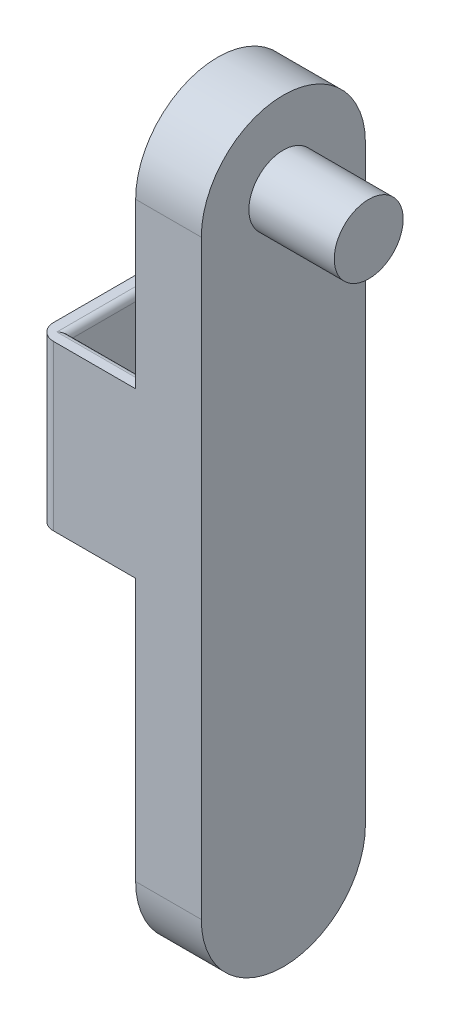
from build123d import *

# Parameters (mm, degrees)
BOSS_EXTRUDE1_DEPTH = 2
SKETCH2_R           = 1.05
BOSS_EXTRUDE2_DEPTH = 2.6
SKETCH3_W           = 3
SKETCH3_H           = 5
BOSS_EXTRUDE3_DEPTH = 5
SKETCH4_W           = 2
SKETCH4_H           = 4
CUT_EXTRUDE1_DEPTH  = 24.631588809
FILLET1_R           = 0.5
FILLET2_R           = 0.2


with BuildPart() as part:
    # Sketch1 → Boss-Extrude1 (new body)
    with BuildSketch(Plane(origin=(0, 0, 0), x_dir=(0, 0, -1), z_dir=(1, 0, 0))):
        with BuildLine():
            Line((-17.23490614, 15.515536013), (-17.23490614, -2.484463987))
            ThreePointArc((-17.23490614, -2.484463987), (-14.73490614, -4.984463987), (-12.23490614, -2.484463987))
            Line((-12.23490614, -2.484463987), (-12.23490614, 15.515536013))
            ThreePointArc((-12.23490614, 15.515536013), (-14.73490614, 18.015536013), (-17.23490614, 15.515536013))
        make_face()
    extrude(amount=BOSS_EXTRUDE1_DEPTH)

    # Sketch2 → Boss-Extrude2 (add)
    with BuildSketch(Plane(origin=(2, 0, 0), x_dir=(0, 0, -1), z_dir=(1, 0, 0))):
        with Locations(Location((-14.73490614, 15.515536013, 0), (0, 0, 180))):
            Circle(SKETCH2_R)
    extrude(amount=BOSS_EXTRUDE2_DEPTH)

    # Sketch3 → Boss-Extrude3 (add)
    with BuildSketch(Plane(origin=(0, 0, 12.23490614), x_dir=(-1, 0, 0), z_dir=(0, 0, -1))):
        with Locations((1.5, 8.015536013)):
            Rectangle(SKETCH3_W, SKETCH3_H)
    extrude(amount=-BOSS_EXTRUDE3_DEPTH)

    # Sketch4 → Cut-Extrude1 (cut, through all)
    with BuildSketch(Plane(origin=(0, 10.515536013, 0), x_dir=(1, 0, 0), z_dir=(0, 1, 0))):
        with Locations((-1.5, -14.73490614)):
            Rectangle(SKETCH4_W, SKETCH4_H)
    extrude(amount=-CUT_EXTRUDE1_DEPTH, mode=Mode.SUBTRACT)

    # Fillet1
    fillet1_edges = [part.edges().sort_by_distance(p)[0] for p in [
        (-3, 8.015536013, 12.23490614),
        (-3, 8.015536013, 17.23490614),
    ]]
    fillet(fillet1_edges, radius=FILLET1_R)

    # Fillet2
    fillet2_edges = [part.edges().sort_by_distance(p)[0] for p in [
        (-1.5, 5.515536013, 12.73490614),
        (-2.5, 5.515536013, 14.73490614),
        (-1.5, 5.515536013, 16.73490614),
        (-0.5, 5.515536013, 14.73490614),
        (-0.5, 10.515536013, 14.73490614),
        (-1.5, 10.515536013, 12.73490614),
        (-2.5, 10.515536013, 14.73490614),
        (-1.5, 10.515536013, 16.73490614),
    ]]
    fillet(fillet2_edges, radius=FILLET2_R)


solid = part.part
